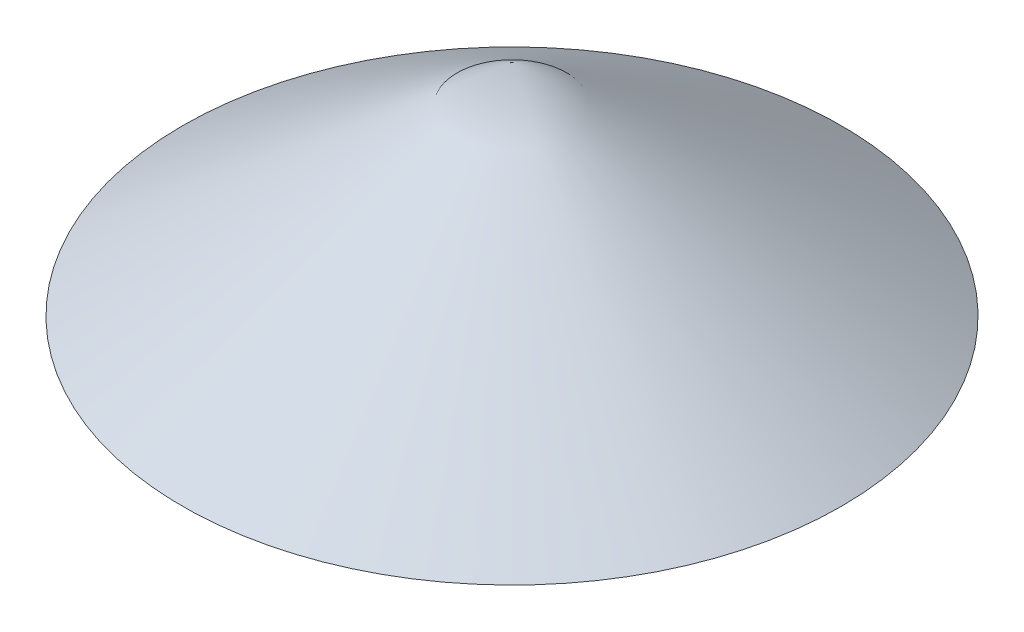
from build123d import *


with BuildPart() as part:
    # Sketch1 → Revolve1 (revolve)
    with BuildSketch(Plane.XY):
        Polygon((0, 0), (30, 0), (0, 20), align=None)
    revolve(axis=Axis((0, 20, 0), (0, -1, 0)))


solid = part.part
